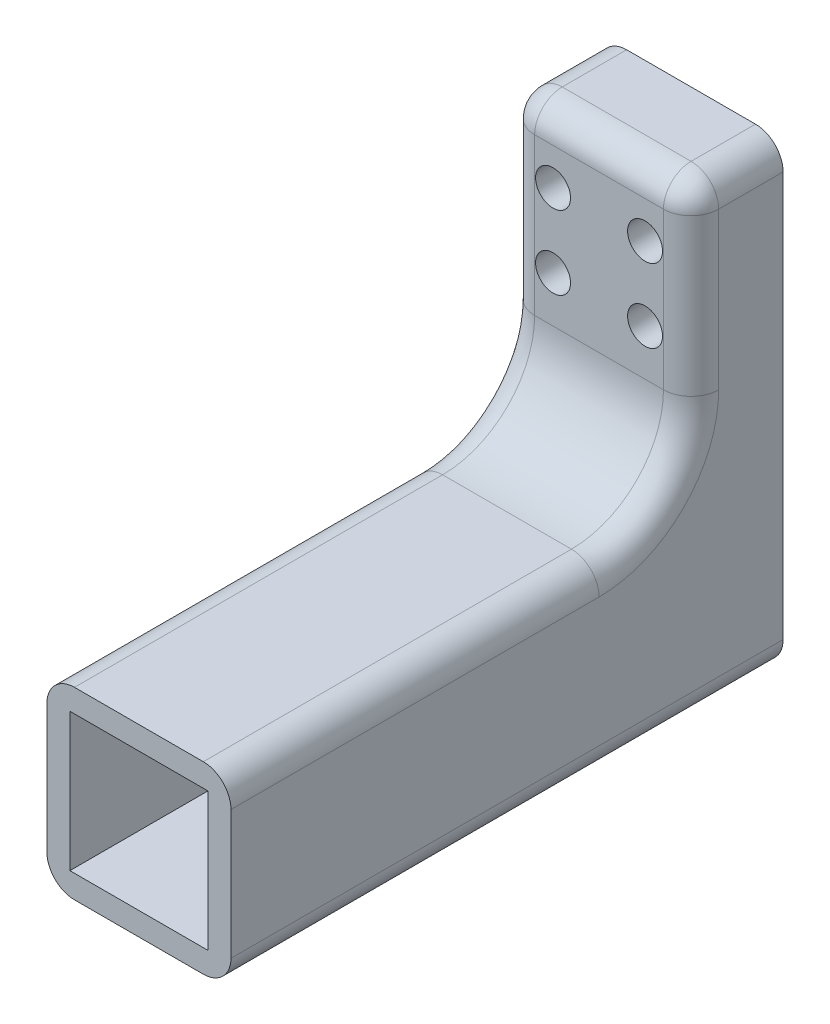
from build123d import *

# Parameters (mm, degrees)
SKETCH_4_W          = 20
SKETCH_4_H          = 20
SKETCH_4_W_2        = 15
SKETCH_4_H_2        = 15
EXTRUDE_3_DEPTH     = 60
SKETCH_5_W          = 20
SKETCH_5_H          = 30
EXTRUDE_4_DEPTH     = 10
FILLET_1_R          = 10
FILLET_2_R          = 3
FILLET_3_R          = 3
SKETCH_6_R          = 1.9
CUT_EXTRUDE_1_DEPTH = 10


with BuildPart() as part:
    # ｽｹｯﾁ4 → ﾎﾞｽ - 押し出し3 (new body)
    with BuildSketch(Plane.XY):
        Rectangle(SKETCH_4_W, SKETCH_4_H)
        Rectangle(SKETCH_4_W_2, SKETCH_4_H_2, mode=Mode.SUBTRACT)
    extrude(amount=EXTRUDE_3_DEPTH)

    # ｽｹｯﾁ5 → ﾎﾞｽ - 押し出し4 (add)
    with BuildSketch(Plane.XY):
        with Locations((0, 25)):
            Rectangle(SKETCH_5_W, SKETCH_5_H)
    extrude(amount=EXTRUDE_4_DEPTH)

    # ﾌｨﾚｯﾄ1
    fillet_1_edges = [part.edges().sort_by_distance(p)[0] for p in [
        (0, 10, 10),
    ]]
    fillet(fillet_1_edges, radius=FILLET_1_R)

    # ﾌｨﾚｯﾄ2
    fillet_2_edges = [part.edges().sort_by_distance(p)[0] for p in [
        (10, 40, 5),
        (-10, 40, 5),
        (0, 40, 10),
        (-10, 30, 10),
        (10, 30, 10),
        (10, 12.928932188, 12.928932188),
        (-10, 12.928932188, 12.928932188),
        (-10, 10, 40),
        (10, 10, 40),
    ]]
    fillet(fillet_2_edges, radius=FILLET_2_R)

    # ﾌｨﾚｯﾄ3
    fillet_3_edges = [part.edges().sort_by_distance(p)[0] for p in [
        (10, -10, 30),
        (-10, -10, 30),
    ]]
    fillet(fillet_3_edges, radius=FILLET_3_R)

    # ｽｹｯﾁ6 → ｶｯﾄ - 押し出し1 (cut)
    with BuildSketch(Plane.XY):
        with Locations((5, 25)):
            Circle(SKETCH_6_R)
        with Locations((5, 33)):
            Circle(SKETCH_6_R)
        with Locations((-5, 33)):
            Circle(SKETCH_6_R)
        with Locations((-5, 25)):
            Circle(SKETCH_6_R)
    extrude(amount=CUT_EXTRUDE_1_DEPTH, mode=Mode.SUBTRACT)


solid = part.part
